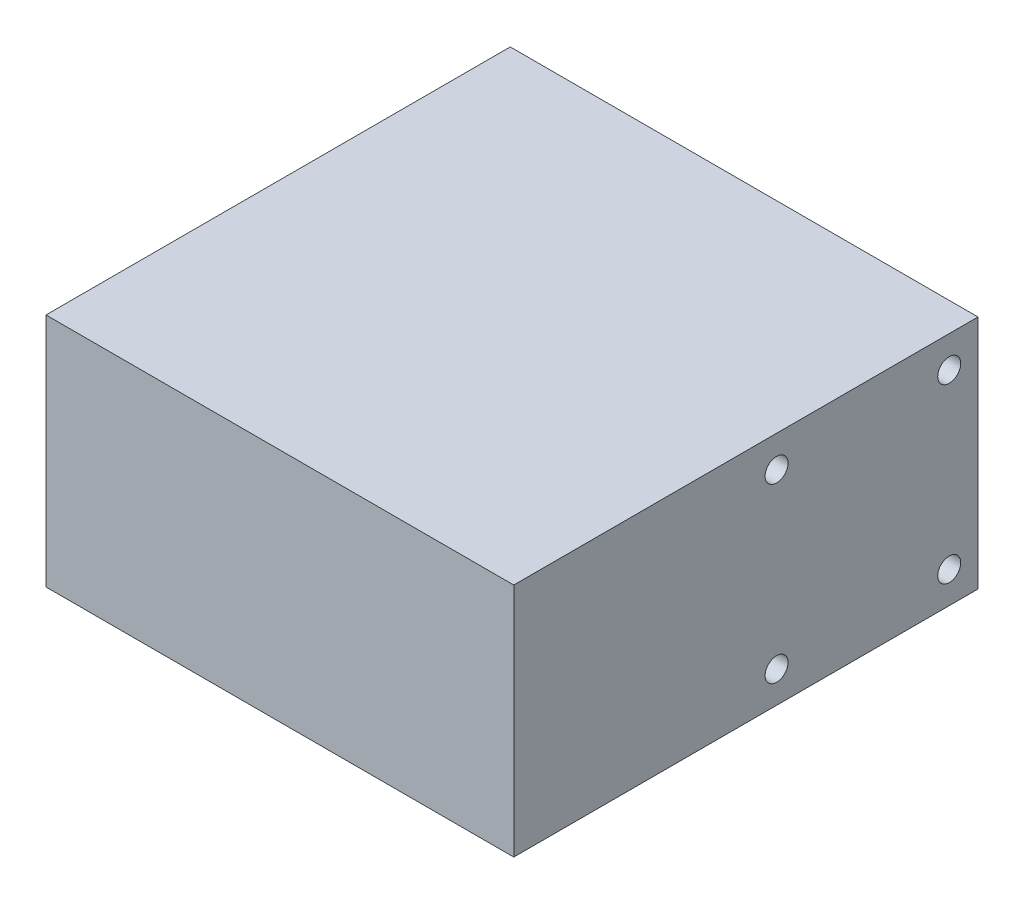
from build123d import *

# Parameters (mm, degrees)
SKETCH1_W           = 40.64
SKETCH1_H           = 40.3352
BOSS_EXTRUDE1_DEPTH = 20.4724
SKETCH3_R           = 2.921
SKETCH3_R_2         = 0.6985
BOSS_EXTRUDE2_DEPTH = 5.08
SKETCH4_R           = 1
CUT_EXTRUDE1_DEPTH  = 61.808363905


with BuildPart() as part:
    # Sketch1 → Boss-Extrude1 (new body)
    with BuildSketch(Plane(origin=(0, 0, 0), x_dir=(1, 0, 0), z_dir=(0, 1, 0))):
        with Locations((20.32, 20.1676)):
            Rectangle(SKETCH1_W, SKETCH1_H)
    extrude(amount=BOSS_EXTRUDE1_DEPTH)

    # Sketch3 → Boss-Extrude2 (add)
    with BuildSketch(Plane.ZY):
        with Locations(Location((-10.541, 10.2362, 0), (0, 0, 180))):
            Circle(SKETCH3_R)
        with Locations((-10.541, 10.2362)):
            Circle(SKETCH3_R_2, mode=Mode.SUBTRACT)
    extrude(amount=BOSS_EXTRUDE2_DEPTH)

    # Sketch4 → Cut-Extrude1 (cut, through all)
    with BuildSketch(Plane.ZY):
        with Locations((-37.8352, 17.736)):
            Circle(SKETCH4_R)
        with Locations((-37.8352, 2.736)):
            Circle(SKETCH4_R)
        with Locations((-22.8352, 17.736)):
            Circle(SKETCH4_R)
        with Locations((-22.8352, 2.736)):
            Circle(SKETCH4_R)
    extrude(amount=-CUT_EXTRUDE1_DEPTH, mode=Mode.SUBTRACT)


solid = part.part
